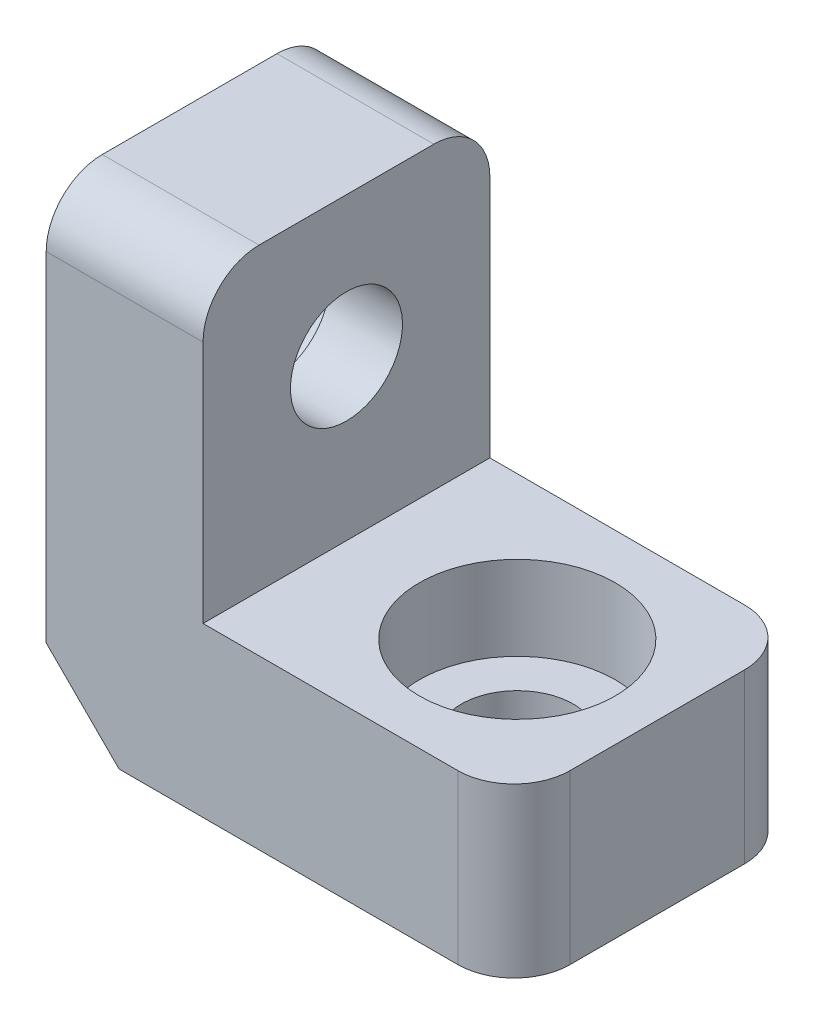
from build123d import *

# Parameters (mm, degrees)
BOSS_EXTRU_1_DEPTH                                 = 5.12
CHAMBRAGE_POUR_VIS_T_TE_HEXAGONALE_M21_D           = 2
CHAMBRAGE_POUR_VIS_T_TE_HEXAGONALE_M21_CBORE_D     = 3.5
CHAMBRAGE_POUR_VIS_T_TE_HEXAGONALE_M21_CBORE_DEPTH = 1.5
CHAMBRAGE_POUR_VIS_T_TE_HEXAGONALE_M22_D           = 2
CHAMBRAGE_POUR_VIS_T_TE_HEXAGONALE_M22_CBORE_D     = 3.5
CHAMBRAGE_POUR_VIS_T_TE_HEXAGONALE_M22_CBORE_DEPTH = 1.5
CHANFREIN1_SIZE                                    = 1.3
CONG_1_R                                           = 1


with BuildPart() as part:
    # Esquisse1 → Boss.-Extru.1 (new body)
    with BuildSketch(Plane.XY):
        Polygon((0, 0), (0, 8.35), (2.8, 8.35), (2.8, 3), (8.35, 3), (8.35, 0), align=None)
    extrude(amount=BOSS_EXTRU_1_DEPTH)

    # Chambrage pour vis à tête hexagonale M21 (through all)
    with Locations(Plane(origin=(0, 3, 0), x_dir=(-1, 0, 0), z_dir=(0, 1, 0))):
        with Locations((-5.85, 2.56)):
            CounterBoreHole(CHAMBRAGE_POUR_VIS_T_TE_HEXAGONALE_M21_D / 2, CHAMBRAGE_POUR_VIS_T_TE_HEXAGONALE_M21_CBORE_D / 2, CHAMBRAGE_POUR_VIS_T_TE_HEXAGONALE_M21_CBORE_DEPTH)

    # Chambrage pour vis à tête hexagonale M22 (through all)
    with Locations(Plane.ZY):
        with Locations((2.56, 5.85)):
            CounterBoreHole(CHAMBRAGE_POUR_VIS_T_TE_HEXAGONALE_M22_D / 2, CHAMBRAGE_POUR_VIS_T_TE_HEXAGONALE_M22_CBORE_D / 2, CHAMBRAGE_POUR_VIS_T_TE_HEXAGONALE_M22_CBORE_DEPTH)

    # Chanfrein1
    chanfrein1_edges = [part.edges().sort_by_distance(p)[0] for p in [
        (0, 0, 2.56),
    ]]
    chamfer(chanfrein1_edges, length=CHANFREIN1_SIZE)

    # Congé1
    cong_1_edges = [part.edges().sort_by_distance(p)[0] for p in [
        (1.4, 8.35, 5.12),
        (1.4, 8.35, 0),
        (8.35, 1.5, 5.12),
        (8.35, 1.5, 0),
    ]]
    fillet(cong_1_edges, radius=CONG_1_R)


solid = part.part
